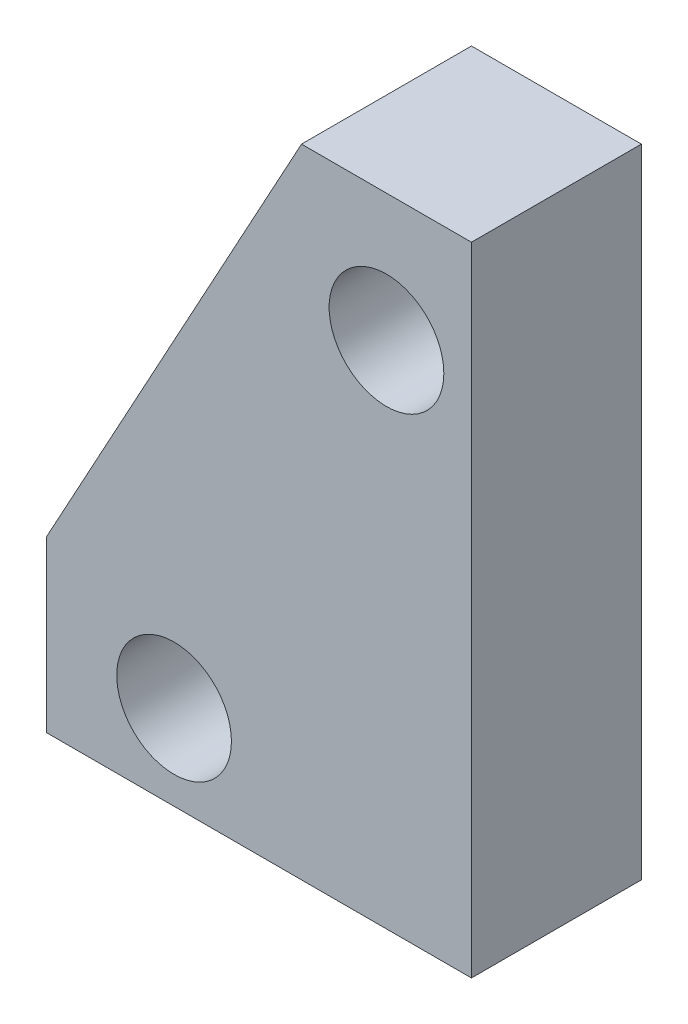
from build123d import *

# Parameters (mm, degrees)
CROQUIS1_R              = 1.35
SALIENTE_EXTRUIR1_DEPTH = 4


with BuildPart() as part:
    # Croquis1 → Saliente-Extruir1 (new body)
    with BuildSketch(Plane.XY):
        Polygon((-172.13312749, 79.201879567), (-162.13312749, 79.201879567), (-162.13312749, 94.201879567), (-166.13312749, 94.201879567), (-172.13312749, 83.201879567), align=None)
        with Locations((-169.13312749, 81.201879567)):
            Circle(CROQUIS1_R, mode=Mode.SUBTRACT)
        with Locations((-164.13312749, 91.201879567)):
            Circle(CROQUIS1_R, mode=Mode.SUBTRACT)
    extrude(amount=SALIENTE_EXTRUIR1_DEPTH)


solid = part.part
